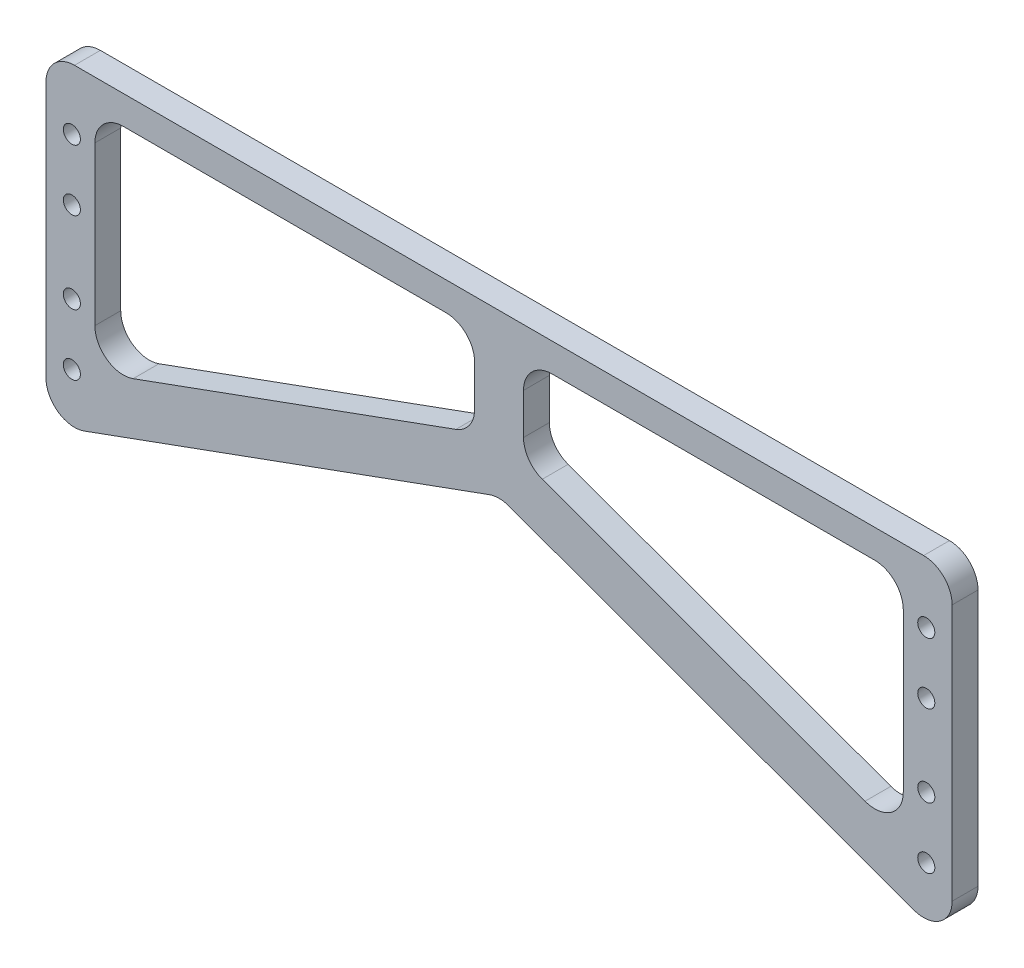
from build123d import *

# Parameters (mm, degrees)
SKETCH1_W                      = 222.5
SKETCH1_H                      = 80
BOSS_EXTRUDE1_DEPTH            = 6.35
CUT_EXTRUDE1_DEPTH             = 119.392926309
CUT_EXTRUDE2_DEPTH             = 119.392926309
M5X0_8_TAPPED_HOLE1_AT_2_COUNT = 2
M5X0_8_TAPPED_HOLE1_AT_2_PITCH = 15
M5X0_8_TAPPED_HOLE1_AT_3_COUNT = 2
M5X0_8_TAPPED_HOLE1_AT_3_PITCH = 50
M5X0_8_TAPPED_HOLE1_AT_4_COUNT = 2
M5X0_8_TAPPED_HOLE1_AT_4_PITCH = 35
FILLET1_R                      = 7


with BuildPart() as part:
    # Sketch1 → Boss-Extrude1 (new body)
    with BuildSketch(Plane.XY):
        Rectangle(SKETCH1_W, SKETCH1_H)
    extrude(amount=BOSS_EXTRUDE1_DEPTH)

    # Sketch2 → Cut-Extrude1 (cut, through all)
    with BuildSketch(Plane.XY.offset(6.35)):
        Polygon((111.25, -40), (0, 0.491688562), (-111.25, -40), align=None)
    extrude(amount=-CUT_EXTRUDE1_DEPTH, mode=Mode.SUBTRACT)

    # Sketch3 → Cut-Extrude2 (cut, through all)
    with BuildSketch(Plane.XY.offset(6.35)):
        Polygon((-99.25, 33), (-99.25, -22.862223919), (-6, 11.078000426), (-6, 33), align=None)
    cut_extrude2 = extrude(amount=-CUT_EXTRUDE2_DEPTH, mode=Mode.SUBTRACT)

    # Sketch4 → M5x0.8 Tapped Hole1 (revolve, cut)
    with BuildSketch(Plane(origin=(-104.9, -25, 0), x_dir=(0, 1, 0), z_dir=(1, 0, 0))):
        Polygon((0, 0), (0, 13.6618073), (2.1, 12.4), (2.1, 0), align=None)
    m5x0_8_tapped_hole1 = revolve(axis=Axis((-104.9, -25, -6.35), (0, 0, 1)), mode=Mode.SUBTRACT)

    # M5x0.8 Tapped Hole1 at 2: M5x0.8 Tapped Hole1 ×2
    with Locations(*[(0, i * M5X0_8_TAPPED_HOLE1_AT_2_PITCH, 0) for i in range(1, M5X0_8_TAPPED_HOLE1_AT_2_COUNT)]):
        add(m5x0_8_tapped_hole1, mode=Mode.SUBTRACT)

    # M5x0.8 Tapped Hole1 at 3: M5x0.8 Tapped Hole1 ×2
    with Locations(*[(0, i * M5X0_8_TAPPED_HOLE1_AT_3_PITCH, 0) for i in range(1, M5X0_8_TAPPED_HOLE1_AT_3_COUNT)]):
        add(m5x0_8_tapped_hole1, mode=Mode.SUBTRACT)

    # M5x0.8 Tapped Hole1 at 4: M5x0.8 Tapped Hole1 ×2
    with Locations(*[(0, i * M5X0_8_TAPPED_HOLE1_AT_4_PITCH, 0) for i in range(1, M5X0_8_TAPPED_HOLE1_AT_4_COUNT)]):
        add(m5x0_8_tapped_hole1, mode=Mode.SUBTRACT)

    # Mirror1: Cut-Extrude2, M5x0.8 Tapped Hole1 across plane
    add(cut_extrude2.mirror(Plane(origin=(0, 0, 0), x_dir=(0, 0, 1), z_dir=(1, 0, 0))), mode=Mode.SUBTRACT)
    add(m5x0_8_tapped_hole1.mirror(Plane(origin=(0, 0, 0), x_dir=(0, 0, 1), z_dir=(1, 0, 0))), mode=Mode.SUBTRACT)

    # Mirror1 copy 1 sketch → Mirror1 copy 1 (revolve, cut)
    with BuildSketch(Plane(origin=(104.9, -10, 0), x_dir=(0, 1, 0), z_dir=(-1, 0, 0))):
        Polygon((0, 0), (0, -13.6618073), (2.1, -12.4), (2.1, 0), align=None)
    revolve(axis=Axis((104.9, -10, -6.35), (0, 0, -1)), mode=Mode.SUBTRACT)

    # Mirror1 copy 2 sketch → Mirror1 copy 2 (revolve, cut)
    with BuildSketch(Plane(origin=(104.9, 25, 0), x_dir=(0, 1, 0), z_dir=(-1, 0, 0))):
        Polygon((0, 0), (0, -13.6618073), (2.1, -12.4), (2.1, 0), align=None)
    revolve(axis=Axis((104.9, 25, -6.35), (0, 0, -1)), mode=Mode.SUBTRACT)

    # Mirror1 copy 3 sketch → Mirror1 copy 3 (revolve, cut)
    with BuildSketch(Plane(origin=(104.9, 10, 0), x_dir=(0, 1, 0), z_dir=(-1, 0, 0))):
        Polygon((0, 0), (0, -13.6618073), (2.1, -12.4), (2.1, 0), align=None)
    revolve(axis=Axis((104.9, 10, -6.35), (0, 0, -1)), mode=Mode.SUBTRACT)

    # Fillet1
    fillet1_edges = [part.edges().sort_by_distance(p)[0] for p in [
        (0, 0.491688562, 3.175),
        (-99.25, 33, 3.175),
        (-6, 33, 3.175),
        (-6, 11.078000426, 3.175),
        (-99.25, -22.862223919, 3.175),
        (6, 33, 3.175),
        (99.25, 33, 3.175),
        (99.25, -22.862223919, 3.175),
        (6, 11.078000426, 3.175),
        (111.25, -40, 3.175),
        (-111.25, -40, 3.175),
        (-111.25, 40, 3.175),
        (111.25, 40, 3.175),
    ]]
    fillet(fillet1_edges, radius=FILLET1_R)


solid = part.part
